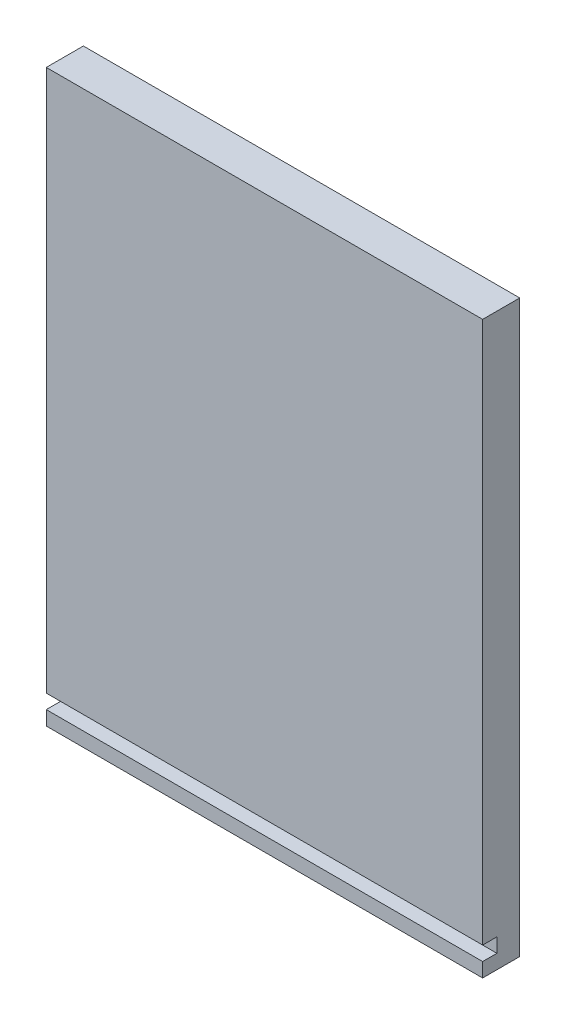
from build123d import *

# Parameters (mm, degrees)
SKETCH_1_W          = 153
SKETCH_1_H          = 200
EXTRUDE_1_DEPTH     = 13
SKETCH_2_W          = 153
SKETCH_2_H          = 5
CUT_EXTRUDE_1_DEPTH = 5


with BuildPart() as part:
    # ｽｹｯﾁ1 → ﾎﾞｽ - 押し出し1 (new body)
    with BuildSketch(Plane.XY):
        with Locations((22.519868277, 33.335714286)):
            Rectangle(SKETCH_1_W, SKETCH_1_H)
    extrude(amount=EXTRUDE_1_DEPTH)

    # ｽｹｯﾁ2 → ｶｯﾄ - 押し出し1 (cut)
    with BuildSketch(Plane.XY.offset(13)):
        with Locations((22.519868277, -59.164285714)):
            Rectangle(SKETCH_2_W, SKETCH_2_H)
    extrude(amount=-CUT_EXTRUDE_1_DEPTH, mode=Mode.SUBTRACT)


solid = part.part
